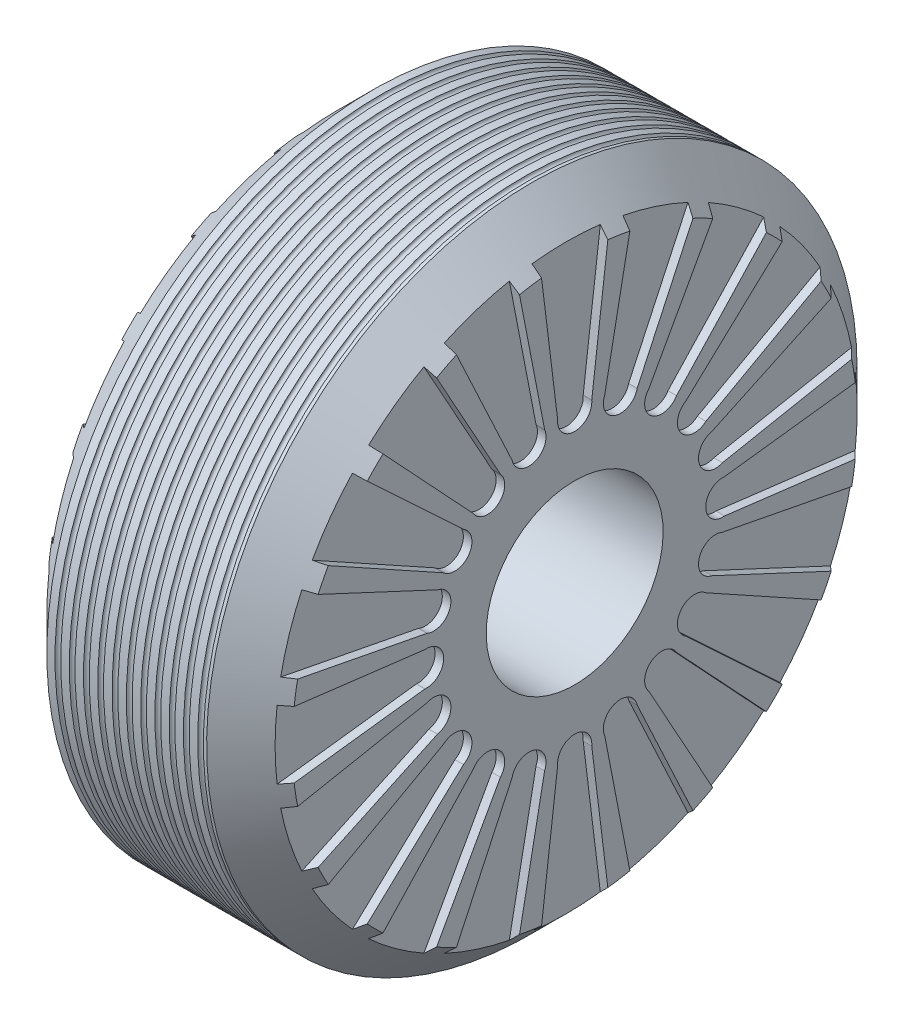
from build123d import *

# Parameters (mm, degrees)
SKETCH1_R             = 114
BOSS_EXTRUDE2_DEPTH   = 86
CHAMFER1_SIZE         = 15
CUT_EXTRUDE1_DEPTH    = 3
CIRPATTERN1_COUNT     = 20
MIRROR3_COPY_1_DEPTH  = 3
MIRROR3_COPY_2_DEPTH  = 3
MIRROR3_COPY_3_DEPTH  = 3
MIRROR3_COPY_4_DEPTH  = 3
MIRROR3_COPY_5_DEPTH  = 3
MIRROR3_COPY_6_DEPTH  = 3
MIRROR3_COPY_7_DEPTH  = 3
MIRROR3_COPY_8_DEPTH  = 3
MIRROR3_COPY_9_DEPTH  = 3
MIRROR3_COPY_10_DEPTH = 3
MIRROR3_COPY_11_DEPTH = 3
MIRROR3_COPY_12_DEPTH = 3
MIRROR3_COPY_13_DEPTH = 3
MIRROR3_COPY_14_DEPTH = 3
MIRROR3_COPY_15_DEPTH = 3
MIRROR3_COPY_16_DEPTH = 3
MIRROR3_COPY_17_DEPTH = 3
MIRROR3_COPY_18_DEPTH = 3
MIRROR3_COPY_19_DEPTH = 3
LPATTERN3_COUNT       = 6
LPATTERN3_PITCH       = 5
LPATTERN3_COL_COUNT   = 6
LPATTERN3_COL_PITCH   = 5
SKETCH7_R             = 4
CUT_EXTRUDE3_DEPTH    = 10


with BuildPart() as part:
    # Sketch1 → Boss-Extrude2 (new body)
    with BuildSketch(Plane(origin=(0, 0, 0), x_dir=(0, 0, -1), z_dir=(1, 0, 0))):
        Circle(SKETCH1_R)
    extrude(amount=BOSS_EXTRUDE2_DEPTH)

    # Chamfer1
    chamfer1_edges = [part.edges().sort_by_distance(p)[0] for p in [
        (0, 0, 114),
        (86, 0, 114),
    ]]
    chamfer(chamfer1_edges, length=CHAMFER1_SIZE)

    # Sketch2 → Cut-Extrude1 (cut)
    with BuildSketch(Plane(origin=(86, 0, 0), x_dir=(0, 0, -1), z_dir=(1, 0, 0))):
        with BuildLine():
            Line((12.5, 105.5), (-12.5, 105.5))
            Line((-12.5, 105.5), (-5.972628685, 52.5))
            ThreePointArc((-5.972628685, 52.5), (0, 45.927543368), (5.972628685, 52.5))
            Line((5.972628685, 52.5), (12.5, 105.5))
        make_face()
    cut_extrude1 = extrude(amount=-CUT_EXTRUDE1_DEPTH, mode=Mode.SUBTRACT)

    # CirPattern1: Cut-Extrude1 ×20 about axis
    cirpattern1_axis = Axis((0, 0, 0), (1, 0, 0))
    for i in range(1, CIRPATTERN1_COUNT):
        add(cut_extrude1.rotate(cirpattern1_axis, i * 360 / CIRPATTERN1_COUNT), mode=Mode.SUBTRACT)

    # Mirror3: Cut-Extrude1 across plane
    add(cut_extrude1.mirror(Plane.ZY.offset(-43)), mode=Mode.SUBTRACT)

    # Mirror3 copy 1 sketch → Mirror3 copy 1 (cut)
    with BuildSketch(Plane(origin=(0, 0, 0), x_dir=(0, 0.3090169943749474, -0.9510565162951535), z_dir=(-1, 0, 0))):
        with BuildLine():
            Line((12.5, -105.5), (-12.5, -105.5))
            Line((-12.5, -105.5), (-5.972628685, -52.5))
            ThreePointArc((-5.972628685, -52.5), (0, -45.927543368), (5.972628685, -52.5))
            Line((5.972628685, -52.5), (12.5, -105.5))
        make_face()
    extrude(amount=-MIRROR3_COPY_1_DEPTH, mode=Mode.SUBTRACT)

    # Mirror3 copy 2 sketch → Mirror3 copy 2 (cut)
    with BuildSketch(Plane(origin=(0, 0, 0), x_dir=(0, 0.5877852522924731, -0.8090169943749475), z_dir=(-1, 0, 0))):
        with BuildLine():
            Line((12.5, -105.5), (-12.5, -105.5))
            Line((-12.5, -105.5), (-5.972628685, -52.5))
            ThreePointArc((-5.972628685, -52.5), (0, -45.927543368), (5.972628685, -52.5))
            Line((5.972628685, -52.5), (12.5, -105.5))
        make_face()
    extrude(amount=-MIRROR3_COPY_2_DEPTH, mode=Mode.SUBTRACT)

    # Mirror3 copy 3 sketch → Mirror3 copy 3 (cut)
    with BuildSketch(Plane(origin=(0, 0, 0), x_dir=(0, 0.8090169943749475, -0.5877852522924731), z_dir=(-1, 0, 0))):
        with BuildLine():
            Line((12.5, -105.5), (-12.5, -105.5))
            Line((-12.5, -105.5), (-5.972628685, -52.5))
            ThreePointArc((-5.972628685, -52.5), (0, -45.927543368), (5.972628685, -52.5))
            Line((5.972628685, -52.5), (12.5, -105.5))
        make_face()
    extrude(amount=-MIRROR3_COPY_3_DEPTH, mode=Mode.SUBTRACT)

    # Mirror3 copy 4 sketch → Mirror3 copy 4 (cut)
    with BuildSketch(Plane(origin=(0, 0, 0), x_dir=(0, 0.9510565162951535, -0.30901699437494745), z_dir=(-1, 0, 0))):
        with BuildLine():
            Line((12.5, -105.5), (-12.5, -105.5))
            Line((-12.5, -105.5), (-5.972628685, -52.5))
            ThreePointArc((-5.972628685, -52.5), (0, -45.927543368), (5.972628685, -52.5))
            Line((5.972628685, -52.5), (12.5, -105.5))
        make_face()
    extrude(amount=-MIRROR3_COPY_4_DEPTH, mode=Mode.SUBTRACT)

    # Mirror3 copy 5 sketch → Mirror3 copy 5 (cut)
    with BuildSketch(Plane(origin=(0, 0, 0), x_dir=(0, 1, 0), z_dir=(-1, 0, 0))):
        with BuildLine():
            Line((12.5, -105.5), (-12.5, -105.5))
            Line((-12.5, -105.5), (-5.972628685, -52.5))
            ThreePointArc((-5.972628685, -52.5), (0, -45.927543368), (5.972628685, -52.5))
            Line((5.972628685, -52.5), (12.5, -105.5))
        make_face()
    extrude(amount=-MIRROR3_COPY_5_DEPTH, mode=Mode.SUBTRACT)

    # Mirror3 copy 6 sketch → Mirror3 copy 6 (cut)
    with BuildSketch(Plane(origin=(0, 0, 0), x_dir=(0, 0.9510565162951536, 0.30901699437494734), z_dir=(-1, 0, 0))):
        with BuildLine():
            Line((12.5, -105.5), (-12.5, -105.5))
            Line((-12.5, -105.5), (-5.972628685, -52.5))
            ThreePointArc((-5.972628685, -52.5), (0, -45.927543368), (5.972628685, -52.5))
            Line((5.972628685, -52.5), (12.5, -105.5))
        make_face()
    extrude(amount=-MIRROR3_COPY_6_DEPTH, mode=Mode.SUBTRACT)

    # Mirror3 copy 7 sketch → Mirror3 copy 7 (cut)
    with BuildSketch(Plane(origin=(0, 0, 0), x_dir=(0, 0.8090169943749475, 0.587785252292473), z_dir=(-1, 0, 0))):
        with BuildLine():
            Line((12.5, -105.5), (-12.5, -105.5))
            Line((-12.5, -105.5), (-5.972628685, -52.5))
            ThreePointArc((-5.972628685, -52.5), (0, -45.927543368), (5.972628685, -52.5))
            Line((5.972628685, -52.5), (12.5, -105.5))
        make_face()
    extrude(amount=-MIRROR3_COPY_7_DEPTH, mode=Mode.SUBTRACT)

    # Mirror3 copy 8 sketch → Mirror3 copy 8 (cut)
    with BuildSketch(Plane(origin=(0, 0, 0), x_dir=(0, 0.5877852522924732, 0.8090169943749473), z_dir=(-1, 0, 0))):
        with BuildLine():
            Line((12.5, -105.5), (-12.5, -105.5))
            Line((-12.5, -105.5), (-5.972628685, -52.5))
            ThreePointArc((-5.972628685, -52.5), (0, -45.927543368), (5.972628685, -52.5))
            Line((5.972628685, -52.5), (12.5, -105.5))
        make_face()
    extrude(amount=-MIRROR3_COPY_8_DEPTH, mode=Mode.SUBTRACT)

    # Mirror3 copy 9 sketch → Mirror3 copy 9 (cut)
    with BuildSketch(Plane(origin=(0, 0, 0), x_dir=(0, 0.3090169943749475, 0.9510565162951535), z_dir=(-1, 0, 0))):
        with BuildLine():
            Line((12.5, -105.5), (-12.5, -105.5))
            Line((-12.5, -105.5), (-5.972628685, -52.5))
            ThreePointArc((-5.972628685, -52.5), (0, -45.927543368), (5.972628685, -52.5))
            Line((5.972628685, -52.5), (12.5, -105.5))
        make_face()
    extrude(amount=-MIRROR3_COPY_9_DEPTH, mode=Mode.SUBTRACT)

    # Mirror3 copy 10 sketch → Mirror3 copy 10 (cut)
    with BuildSketch(Plane.ZY):
        with BuildLine():
            Line((12.5, -105.5), (-12.5, -105.5))
            Line((-12.5, -105.5), (-5.972628685, -52.5))
            ThreePointArc((-5.972628685, -52.5), (0, -45.927543368), (5.972628685, -52.5))
            Line((5.972628685, -52.5), (12.5, -105.5))
        make_face()
    extrude(amount=-MIRROR3_COPY_10_DEPTH, mode=Mode.SUBTRACT)

    # Mirror3 copy 11 sketch → Mirror3 copy 11 (cut)
    with BuildSketch(Plane(origin=(0, 0, 0), x_dir=(0, -0.3090169943749473, 0.9510565162951536), z_dir=(-1, 0, 0))):
        with BuildLine():
            Line((12.5, -105.5), (-12.5, -105.5))
            Line((-12.5, -105.5), (-5.972628685, -52.5))
            ThreePointArc((-5.972628685, -52.5), (0, -45.927543368), (5.972628685, -52.5))
            Line((5.972628685, -52.5), (12.5, -105.5))
        make_face()
    extrude(amount=-MIRROR3_COPY_11_DEPTH, mode=Mode.SUBTRACT)

    # Mirror3 copy 12 sketch → Mirror3 copy 12 (cut)
    with BuildSketch(Plane(origin=(0, 0, 0), x_dir=(0, -0.587785252292473, 0.8090169943749476), z_dir=(-1, 0, 0))):
        with BuildLine():
            Line((12.5, -105.5), (-12.5, -105.5))
            Line((-12.5, -105.5), (-5.972628685, -52.5))
            ThreePointArc((-5.972628685, -52.5), (0, -45.927543368), (5.972628685, -52.5))
            Line((5.972628685, -52.5), (12.5, -105.5))
        make_face()
    extrude(amount=-MIRROR3_COPY_12_DEPTH, mode=Mode.SUBTRACT)

    # Mirror3 copy 13 sketch → Mirror3 copy 13 (cut)
    with BuildSketch(Plane(origin=(0, 0, 0), x_dir=(0, -0.8090169943749473, 0.5877852522924732), z_dir=(-1, 0, 0))):
        with BuildLine():
            Line((12.5, -105.5), (-12.5, -105.5))
            Line((-12.5, -105.5), (-5.972628685, -52.5))
            ThreePointArc((-5.972628685, -52.5), (0, -45.927543368), (5.972628685, -52.5))
            Line((5.972628685, -52.5), (12.5, -105.5))
        make_face()
    extrude(amount=-MIRROR3_COPY_13_DEPTH, mode=Mode.SUBTRACT)

    # Mirror3 copy 14 sketch → Mirror3 copy 14 (cut)
    with BuildSketch(Plane(origin=(0, 0, 0), x_dir=(0, -0.9510565162951535, 0.30901699437494756), z_dir=(-1, 0, 0))):
        with BuildLine():
            Line((12.5, -105.5), (-12.5, -105.5))
            Line((-12.5, -105.5), (-5.972628685, -52.5))
            ThreePointArc((-5.972628685, -52.5), (0, -45.927543368), (5.972628685, -52.5))
            Line((5.972628685, -52.5), (12.5, -105.5))
        make_face()
    extrude(amount=-MIRROR3_COPY_14_DEPTH, mode=Mode.SUBTRACT)

    # Mirror3 copy 15 sketch → Mirror3 copy 15 (cut)
    with BuildSketch(Plane(origin=(0, 0, 0), x_dir=(0, -1, 0), z_dir=(-1, 0, 0))):
        with BuildLine():
            Line((12.5, -105.5), (-12.5, -105.5))
            Line((-12.5, -105.5), (-5.972628685, -52.5))
            ThreePointArc((-5.972628685, -52.5), (0, -45.927543368), (5.972628685, -52.5))
            Line((5.972628685, -52.5), (12.5, -105.5))
        make_face()
    extrude(amount=-MIRROR3_COPY_15_DEPTH, mode=Mode.SUBTRACT)

    # Mirror3 copy 16 sketch → Mirror3 copy 16 (cut)
    with BuildSketch(Plane(origin=(0, 0, 0), x_dir=(0, -0.9510565162951536, -0.30901699437494723), z_dir=(-1, 0, 0))):
        with BuildLine():
            Line((12.5, -105.5), (-12.5, -105.5))
            Line((-12.5, -105.5), (-5.972628685, -52.5))
            ThreePointArc((-5.972628685, -52.5), (0, -45.927543368), (5.972628685, -52.5))
            Line((5.972628685, -52.5), (12.5, -105.5))
        make_face()
    extrude(amount=-MIRROR3_COPY_16_DEPTH, mode=Mode.SUBTRACT)

    # Mirror3 copy 17 sketch → Mirror3 copy 17 (cut)
    with BuildSketch(Plane(origin=(0, 0, 0), x_dir=(0, -0.8090169943749476, -0.5877852522924729), z_dir=(-1, 0, 0))):
        with BuildLine():
            Line((12.5, -105.5), (-12.5, -105.5))
            Line((-12.5, -105.5), (-5.972628685, -52.5))
            ThreePointArc((-5.972628685, -52.5), (0, -45.927543368), (5.972628685, -52.5))
            Line((5.972628685, -52.5), (12.5, -105.5))
        make_face()
    extrude(amount=-MIRROR3_COPY_17_DEPTH, mode=Mode.SUBTRACT)

    # Mirror3 copy 18 sketch → Mirror3 copy 18 (cut)
    with BuildSketch(Plane(origin=(0, 0, 0), x_dir=(0, -0.5877852522924734, -0.8090169943749473), z_dir=(-1, 0, 0))):
        with BuildLine():
            Line((12.5, -105.5), (-12.5, -105.5))
            Line((-12.5, -105.5), (-5.972628685, -52.5))
            ThreePointArc((-5.972628685, -52.5), (0, -45.927543368), (5.972628685, -52.5))
            Line((5.972628685, -52.5), (12.5, -105.5))
        make_face()
    extrude(amount=-MIRROR3_COPY_18_DEPTH, mode=Mode.SUBTRACT)

    # Mirror3 copy 19 sketch → Mirror3 copy 19 (cut)
    with BuildSketch(Plane(origin=(0, 0, 0), x_dir=(0, -0.3090169943749476, -0.9510565162951535), z_dir=(-1, 0, 0))):
        with BuildLine():
            Line((12.5, -105.5), (-12.5, -105.5))
            Line((-12.5, -105.5), (-5.972628685, -52.5))
            ThreePointArc((-5.972628685, -52.5), (0, -45.927543368), (5.972628685, -52.5))
            Line((5.972628685, -52.5), (12.5, -105.5))
        make_face()
    extrude(amount=-MIRROR3_COPY_19_DEPTH, mode=Mode.SUBTRACT)

    # Sketch3 → Cut-Revolve3 (revolve, cut)
    with BuildSketch(Plane.XY, mode=Mode.PRIVATE) as cut_revolve3_sk:
        with BuildLine():
            Line((42.866394759, 114), (44.866394759, 114))
            ThreePointArc((44.866394759, 114), (43.866394759, 113), (42.866394759, 114))
        make_face()
    cut_revolve3 = revolve(cut_revolve3_sk.sketch.rotate(Axis((86, 0, 0), (-1, 0, 0)), 90), axis=Axis((86, 0, 0), (-1, 0, 0)), mode=Mode.SUBTRACT)

    # LPattern3: Cut-Revolve3 ×6
    with Locations(*[(-i * LPATTERN3_PITCH, 0, 0) for i in range(1, LPATTERN3_COUNT)]):
        add(cut_revolve3, mode=Mode.SUBTRACT)

    # LPattern3 col: Cut-Revolve3 ×6
    with Locations(*[(i * LPATTERN3_COL_PITCH, 0, 0) for i in range(1, LPATTERN3_COL_COUNT)]):
        add(cut_revolve3, mode=Mode.SUBTRACT)

    # Sketch6 → Cut-Revolve5 (revolve, cut)
    with BuildSketch(Plane.XY):
        Polygon((0, 31), (7, 31), (7, 44), (16.5, 44), (19.866394759, 40.633605241), (19.866394759, 31), (86, 31), (86, 0), (0, 0), align=None)
    revolve(axis=Axis((86, 0, 0), (-1, 0, 0)), mode=Mode.SUBTRACT)

    # Sketch7 → Cut-Extrude3 (cut)
    with BuildSketch(Plane.ZY):
        with Locations((0, 37.5)):
            Circle(SKETCH7_R)
        with Locations((32.475952642, 18.75)):
            Circle(SKETCH7_R)
        with Locations((32.475952642, -18.75)):
            Circle(SKETCH7_R)
        with Locations((0, -37.5)):
            Circle(SKETCH7_R)
        with Locations((-32.475952642, -18.75)):
            Circle(SKETCH7_R)
        with Locations((-32.475952642, 18.75)):
            Circle(SKETCH7_R)
    extrude(amount=-CUT_EXTRUDE3_DEPTH, mode=Mode.SUBTRACT)


solid = part.part
